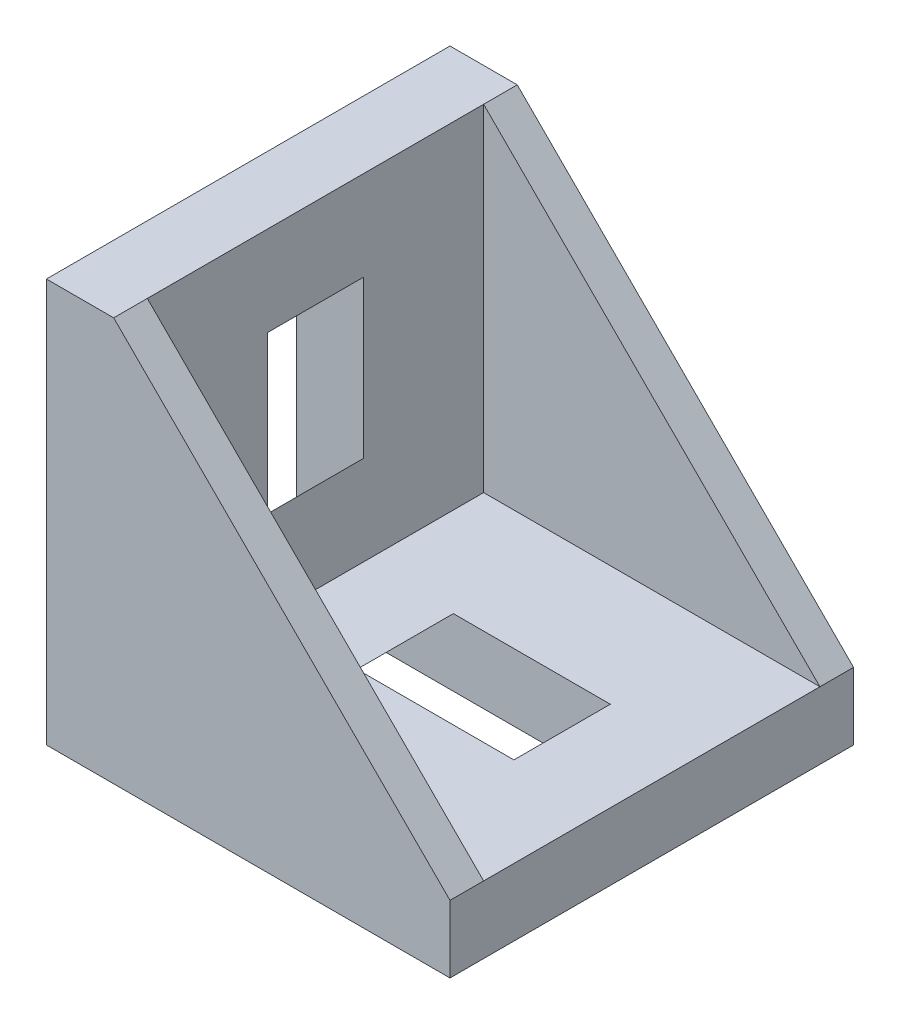
from build123d import *

# Parameters (mm, degrees)
BOSS_EXTRUDE1_DEPTH = 9
CUT_EXTRUDE1_DEPTH  = 7.5
CUT_EXTRUDE2_DEPTH  = 2.15
BOSS_EXTRUDE2_DEPTH = 2.5
SKETCH8_W           = 5
SKETCH8_H           = 2.300783428
SKETCH8_H_2         = 2.300783429
CUT_EXTRUDE6_DEPTH  = 2.54


with BuildPart() as part:
    # Sketch1 → Boss-Extrude1 (new, symmetric)
    with BuildSketch(Plane.XY):
        Polygon((0, 0), (0, 18), (3, 18), (18, 3), (18, 0), align=None)
    extrude(amount=BOSS_EXTRUDE1_DEPTH, both=True)

    # Sketch2 → Cut-Extrude1 (cut, symmetric)
    with BuildSketch(Plane.XY):
        Polygon((3, 18), (3, 3), (18, 3), align=None)
    extrude(amount=CUT_EXTRUDE1_DEPTH, both=True, mode=Mode.SUBTRACT)

    # Sketch3 → Cut-Extrude2 (cut, symmetric)
    with BuildSketch(Plane.XY):
        Polygon((0, 14), (3, 14), (3, 7), (0, 4), align=None)
        Polygon((7, 3), (14, 3), (14, 0), (4, 0), align=None)
    extrude(amount=CUT_EXTRUDE2_DEPTH, both=True, mode=Mode.SUBTRACT)

    # Sketch4 → Boss-Extrude2 (add, symmetric)
    with BuildSketch(Plane.XY):
        Polygon((1.504575227, -1.8), (0.511249685, -0.790946088), (1.234750477, 0), (3.535533906, 0), align=None)
        Polygon((0, 3.535533906), (-1.8, 1.504575227), (-0.790946088, 0.511249685), (0, 1.234750477), align=None)
        Polygon((0, 17.3), (0, 14.999216572), (-0.790946088, 14.275715779), (-1.8, 15.269041321), align=None)
        Polygon((14.999216572, 0), (14.275715779, -0.790946088), (15.269041321, -1.8), (17.3, 0), align=None)
    extrude(amount=BOSS_EXTRUDE2_DEPTH, both=True)

    # Sketch8 → Cut-Extrude6 (cut)
    with BuildSketch(Plane(origin=(114.3, 0, -271.000209725), x_dir=(0, 0, 1), z_dir=(0, 1, 0))):
        with Locations((271.000209725, -98.150391714)):
            Rectangle(SKETCH8_W, SKETCH8_H)
        with Locations((271.000209725, -111.914857809)):
            Rectangle(SKETCH8_W, SKETCH8_H_2)
    extrude(amount=-CUT_EXTRUDE6_DEPTH, mode=Mode.SUBTRACT)


with BuildPart() as cut_extrude6_kept_piece:
    # of the separate pieces the step leaves, the one the design keeps (cut_extrude6_pieces_kept)
    add(part.part.solids().sort_by_distance((0, 0, -9))[0])


solid = cut_extrude6_kept_piece.part
